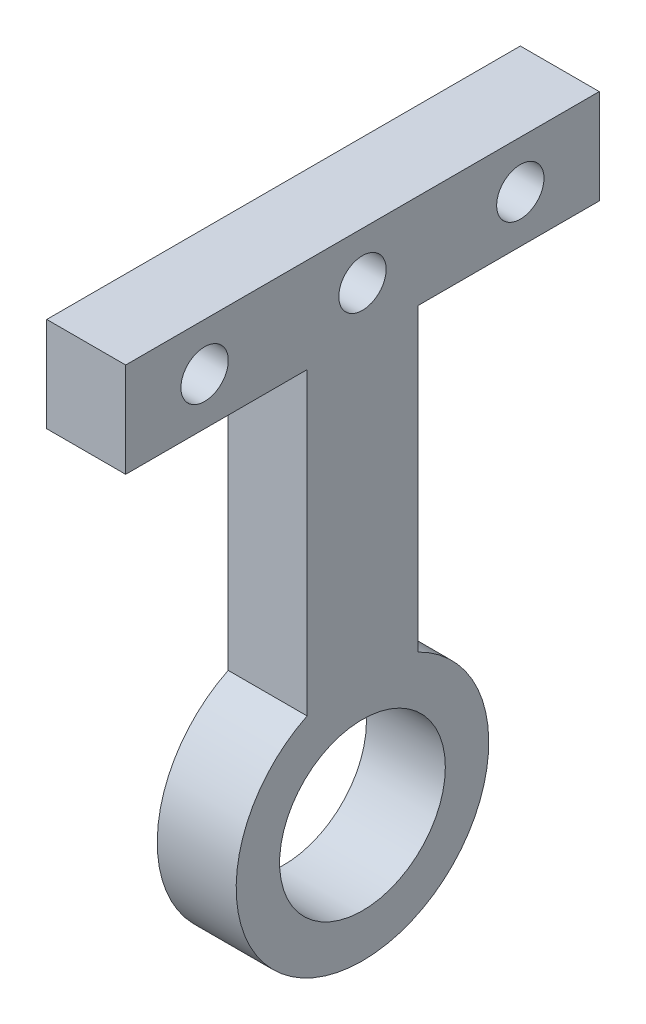
from build123d import *

# Parameters (mm, degrees)
EXTRUDE_1_DEPTH     = 5
SKETCH_5_R          = 5.25
CUT_EXTRUDE_1_DEPTH = 5
EXTRUDE_3_DEPTH     = 5
SKETCH_10_R         = 1.5
CUT_EXTRUDE_2_DEPTH = 36.864078478


with BuildPart() as part:
    # 草图1 → 凸台-拉伸1 (new body)
    with BuildSketch(Plane(origin=(0, 0, 0), x_dir=(0, 0, -1), z_dir=(1, 0, 0))):
        with BuildLine():
            Line((3.506544331, 7.190559565), (3.506544331, 32.190559565))
            Line((3.506544331, 32.190559565), (-3.506544331, 32.190559565))
            Line((-3.506544331, 32.190559565), (-3.506544331, 7.190559565))
            ThreePointArc((-3.506544331, 7.190559565), (0, -8), (3.506544331, 7.190559565))
        make_face()
    extrude(amount=EXTRUDE_1_DEPTH)

    # 草图5 → 切除-拉伸1 (cut)
    with BuildSketch(Plane(origin=(5, 0, 0), x_dir=(0, 0, -1), z_dir=(1, 0, 0))):
        Circle(SKETCH_5_R)
    extrude(amount=-CUT_EXTRUDE_1_DEPTH, mode=Mode.SUBTRACT)

    # 草图9 → 凸台-拉伸3 (add)
    with BuildSketch(Plane(origin=(5, 0, 0), x_dir=(0, 0, -1), z_dir=(1, 0, 0))):
        Polygon((-3.506544331, 32.190559565), (15, 32.190559565), (15, 26.190559565), (-15, 26.190559565), (-15, 32.190559565), align=None)
    extrude(amount=-EXTRUDE_3_DEPTH)

    # 草图10 → 切除-拉伸2 (cut, through all)
    with BuildSketch(Plane.ZY):
        with Locations((0, 29.190559565)):
            Circle(SKETCH_10_R)
        with Locations((-10, 29.190559565)):
            Circle(SKETCH_10_R)
        with Locations((10, 29.190559565)):
            Circle(SKETCH_10_R)
    extrude(amount=-CUT_EXTRUDE_2_DEPTH, mode=Mode.SUBTRACT)


solid = part.part
